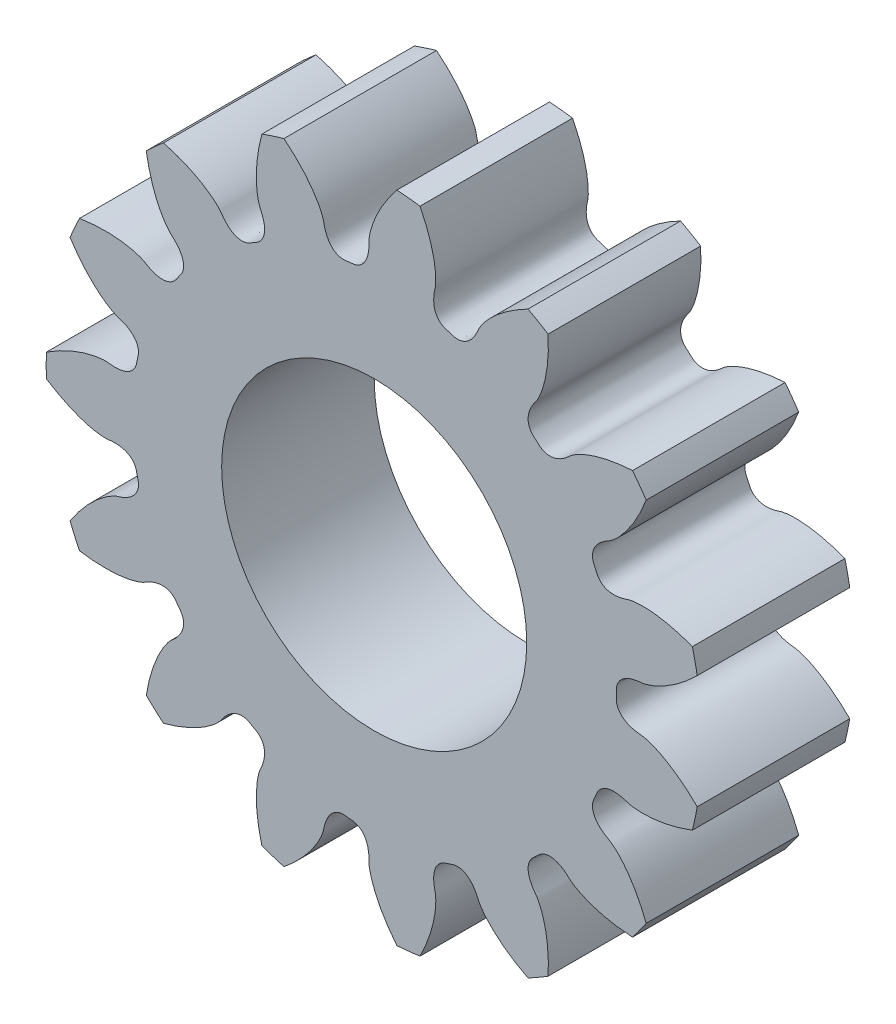
from build123d import *

# Parameters (mm, degrees)
SKETCHREVOLVESPURPINION_W       = 4
SKETCHREVOLVESPURPINION_H       = 8.599999872
TOOTHEXTRUDECUTSPURPINION_DEPTH = 2
PATTERNSPURPINION_COUNT         = 15
BOREREVOLVESKETCH_W             = 4
BOREREVOLVESKETCH_H             = 4


with BuildPart() as part:
    # SketchRevolveSpurPinion → SpurPinion (revolve)
    with BuildSketch(Plane(origin=(0, 0, 0), x_dir=(0, 0, -1), z_dir=(1, 0, 0))):
        with Locations((0, 4.299999936)):
            Rectangle(SKETCHREVOLVESPURPINION_W, SKETCHREVOLVESPURPINION_H)
    revolve(axis=Axis((0, 0, 0), (0, 0, -1)))

    # SketchToothSpurPinion → ToothExtrudeCutSpurPinion (cut, symmetric)
    with BuildSketch(Plane.XY):
        with BuildLine():
            ThreePointArc((8.517467379, 1.53680585), (8.654999872, 0), (8.517467379, -1.53680585))
            add(Edge.make_bspline(
                [(8.517467379, -1.53680585), (8.438278599, -1.455635756), (8.318610121, -1.340963899), (8.155523021, -1.201011327), (8.040046021, -1.108847438), (7.928554255, -1.026185767), (7.821569106, -0.952618636), (7.719587735, -0.887713389), (7.623081966, -0.831013886), (7.532497261, -0.782041694), (7.448251736, -0.740297418), (7.370735262, -0.705262033), (7.300308564, -0.676398322), (7.237302562, -0.653152129), (7.182017246, -0.634954371), (7.134722199, -0.621220884), (7.095652573, -0.611358773), (7.065017971, -0.604754881), (6.998259021, -0.592809844), (6.924348058, -0.591116018), (6.843857571, -0.576386607), (6.797681001, -0.566361465), (6.75305956, -0.554377231), (6.709889583, -0.540492792), (6.668078514, -0.524514538), (6.627522103, -0.506228526), (6.588125699, -0.485313213), (6.549829021, -0.461330935), (6.512655249, -0.433699333), (6.476791375, -0.401683018), (6.442712576, -0.364424583), (6.411328885, -0.321065364), (6.384154183, -0.27099752), (6.363153707, -0.214303629), (6.35193913, -0.156907609), (6.347515352, -0.084870106), (6.351658362, 0), (6.347515352, 0.084870106), (6.35193913, 0.156907609), (6.363153707, 0.214303629), (6.384154183, 0.27099752), (6.411328885, 0.321065364), (6.442712576, 0.364424583), (6.476791375, 0.401683018), (6.512655249, 0.433699333), (6.549829021, 0.461330935), (6.588125699, 0.485313213), (6.627522103, 0.506228526), (6.668078514, 0.524514538), (6.709889583, 0.540492792), (6.75305956, 0.554377231), (6.797681001, 0.566361465), (6.843857571, 0.576386607), (6.924348058, 0.591116018), (6.998259021, 0.592809844), (7.065017971, 0.604754881), (7.095652573, 0.611358773), (7.134722199, 0.621220884), (7.182017246, 0.634954371), (7.237302562, 0.653152129), (7.300308564, 0.676398322), (7.370735262, 0.705262033), (7.448251736, 0.740297418), (7.532497261, 0.782041694), (7.623081966, 0.831013886), (7.719587735, 0.887713389), (7.821569106, 0.952618636), (7.928554255, 1.026185767), (8.040046021, 1.108847438), (8.155523021, 1.201011327), (8.318610121, 1.340963899), (8.438278599, 1.455635756), (8.517467379, 1.53680585)],
                knots=[0, 0, 0, 0, 0.060357343, 0.088153488, 0.114361282, 0.138980724, 0.162011816, 0.183454557, 0.203308946, 0.221574985, 0.238252672, 0.253342008, 0.266842993, 0.278755628, 0.289079911, 0.297815843, 0.304963425, 0.310522656, 0.314493537, 0.341046693, 0.349640819, 0.358013164, 0.366194317, 0.374221498, 0.382140142, 0.390005785, 0.397886142, 0.405863111, 0.414034003, 0.4225106, 0.431413541, 0.44085835, 0.450929542, 0.461643458, 0.472911436, 0.481918211, 0.5, 0.518081789, 0.527088564, 0.538356542, 0.549070458, 0.55914165, 0.568586459, 0.5774894, 0.585965997, 0.594136889, 0.602113858, 0.609994215, 0.617859858, 0.625778502, 0.633805683, 0.641986836, 0.650359181, 0.658953307, 0.685506463, 0.689477344, 0.695036575, 0.702184157, 0.710920089, 0.721244372, 0.733157007, 0.746657992, 0.761747328, 0.778425015, 0.796691054, 0.816545443, 0.837988184, 0.861019276, 0.885638718, 0.911846512, 0.939642657, 1, 1, 1, 1], degree=3))
        make_face()
    toothextrudecutspurpinion = extrude(amount=TOOTHEXTRUDECUTSPURPINION_DEPTH, both=True, mode=Mode.SUBTRACT)

    # PatternSpurPinion: ToothExtrudeCutSpurPinion ×15 about axis
    patternspurpinion_axis = Axis((0, 0, 55), (0, 0, -1))
    for i in range(1, PATTERNSPURPINION_COUNT):
        add(toothextrudecutspurpinion.rotate(patternspurpinion_axis, i * 360 / PATTERNSPURPINION_COUNT), mode=Mode.SUBTRACT)

    # BoreRevolveSketch → BoreRevolveCut (revolve, cut)
    with BuildSketch(Plane(origin=(0, 0, 0), x_dir=(0, 0, -1), z_dir=(1, 0, 0))):
        with Locations((0, 2)):
            Rectangle(BOREREVOLVESKETCH_W, BOREREVOLVESKETCH_H)
    revolve(axis=Axis((0, 0, 0), (0, 0, -1)), mode=Mode.SUBTRACT)


solid = part.part
